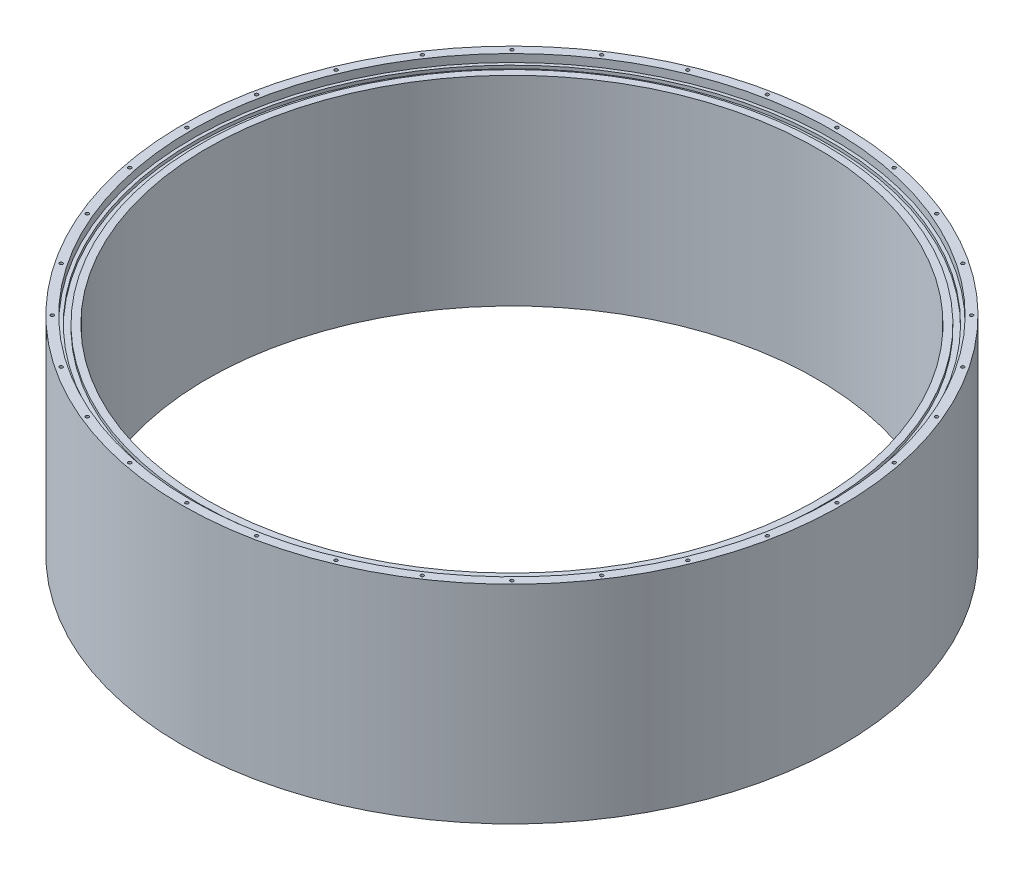
from build123d import *

# Parameters (mm, degrees)
SKETCH2_W         = 4.1656
SKETCH2_H         = 2.413
CIRPATTERN1_COUNT = 32


with BuildPart() as part:
    # Sketch1 → Revolve1 (revolve)
    with BuildSketch(Plane.XY, mode=Mode.PRIVATE) as revolve1_sk:
        Polygon((234.95, 74), (247, 74), (247, 80), (254, 80), (254, -80), (234.95, -80), align=None)
    revolve(revolve1_sk.sketch.rotate(Axis((0, 80, 0), (0, -1, 0)), 90), axis=Axis((0, 80, 0), (0, -1, 0)))

    # Sketch2 → Cut-Revolve1 (revolve, cut)
    with BuildSketch(Plane.XY, mode=Mode.PRIVATE) as cut_revolve1_sk:
        with Locations((242.4172, 72.7935)):
            Rectangle(SKETCH2_W, SKETCH2_H)
        with Locations((242.4172, -78.7935)):
            Rectangle(SKETCH2_W, SKETCH2_H)
    revolve(cut_revolve1_sk.sketch.rotate(Axis((0, 80, 0), (0, -1, 0)), 90), axis=Axis((0, 80, 0), (0, -1, 0)), mode=Mode.SUBTRACT)

    # Sketch4 → M3x0.5 Tapped Hole1 (revolve, cut)
    with BuildSketch(Plane(origin=(250.5, 80, 0), x_dir=(0, 0, 1), z_dir=(1, 0, 0))):
        Polygon((0, 0), (0, 10.251075774), (1.25, 9.5), (1.25, 0), align=None)
    m3x0_5_tapped_hole1 = revolve(axis=Axis((250.5, 86.35, 0), (0, -1, 0)), mode=Mode.SUBTRACT)

    # CirPattern1: M3x0.5 Tapped Hole1 ×32 about axis
    cirpattern1_axis = Axis((0, 0, 0), (0, 1, 0))
    for i in range(1, CIRPATTERN1_COUNT):
        add(m3x0_5_tapped_hole1.rotate(cirpattern1_axis, i * 360 / CIRPATTERN1_COUNT), mode=Mode.SUBTRACT)

    # Mirror1: M3x0.5 Tapped Hole1 across plane
    add(m3x0_5_tapped_hole1.mirror(Plane.ZX), mode=Mode.SUBTRACT)

    # Mirror1 copy 1 sketch → Mirror1 copy 1 (revolve, cut)
    with BuildSketch(Plane(origin=(245.686712741, -80, -48.870125665), x_dir=(0.19509032201612825, 0, 0.9807852804032304), z_dir=(0.9807852804032304, 0, -0.19509032201612825))):
        Polygon((0, 0), (0, -10.251075774), (1.25, -9.5), (1.25, 0), align=None)
    revolve(axis=Axis((245.686712741, -86.35, -48.870125665), (0, -1, 0)), mode=Mode.SUBTRACT)

    # Mirror1 copy 2 sketch → Mirror1 copy 2 (revolve, cut)
    with BuildSketch(Plane(origin=(231.431822894, -80, -95.862199807), x_dir=(0.3826834323650898, 0, 0.9238795325112867), z_dir=(0.9238795325112867, 0, -0.3826834323650898))):
        Polygon((0, 0), (0, -10.251075774), (1.25, -9.5), (1.25, 0), align=None)
    revolve(axis=Axis((231.431822894, -86.35, -95.862199807), (0, -1, 0)), mode=Mode.SUBTRACT)

    # Mirror1 copy 3 sketch → Mirror1 copy 3 (revolve, cut)
    with BuildSketch(Plane(origin=(208.283137882, -80, -139.170343371), x_dir=(0.5555702330196022, 0, 0.8314696123025452), z_dir=(0.8314696123025452, 0, -0.5555702330196022))):
        Polygon((0, 0), (0, -10.251075774), (1.25, -9.5), (1.25, 0), align=None)
    revolve(axis=Axis((208.283137882, -86.35, -139.170343371), (0, -1, 0)), mode=Mode.SUBTRACT)

    # Mirror1 copy 4 sketch → Mirror1 copy 4 (revolve, cut)
    with BuildSketch(Plane(origin=(177.130248687, -80, -177.130248687), x_dir=(0.7071067811865475, 0, 0.7071067811865476), z_dir=(0.7071067811865476, 0, -0.7071067811865475))):
        Polygon((0, 0), (0, -10.251075774), (1.25, -9.5), (1.25, 0), align=None)
    revolve(axis=Axis((177.130248687, -86.35, -177.130248687), (0, -1, 0)), mode=Mode.SUBTRACT)

    # Mirror1 copy 5 sketch → Mirror1 copy 5 (revolve, cut)
    with BuildSketch(Plane(origin=(139.170343371, -80, -208.283137882), x_dir=(0.8314696123025452, 0, 0.5555702330196023), z_dir=(0.5555702330196023, 0, -0.8314696123025452))):
        Polygon((0, 0), (0, -10.251075774), (1.25, -9.5), (1.25, 0), align=None)
    revolve(axis=Axis((139.170343371, -86.35, -208.283137882), (0, -1, 0)), mode=Mode.SUBTRACT)

    # Mirror1 copy 6 sketch → Mirror1 copy 6 (revolve, cut)
    with BuildSketch(Plane(origin=(95.862199807, -80, -231.431822894), x_dir=(0.9238795325112867, 0, 0.38268343236508984), z_dir=(0.38268343236508984, 0, -0.9238795325112867))):
        Polygon((0, 0), (0, -10.251075774), (1.25, -9.5), (1.25, 0), align=None)
    revolve(axis=Axis((95.862199807, -86.35, -231.431822894), (0, -1, 0)), mode=Mode.SUBTRACT)

    # Mirror1 copy 7 sketch → Mirror1 copy 7 (revolve, cut)
    with BuildSketch(Plane(origin=(48.870125665, -80, -245.686712741), x_dir=(0.9807852804032304, 0, 0.19509032201612833), z_dir=(0.19509032201612833, 0, -0.9807852804032304))):
        Polygon((0, 0), (0, -10.251075774), (1.25, -9.5), (1.25, 0), align=None)
    revolve(axis=Axis((48.870125665, -86.35, -245.686712741), (0, -1, 0)), mode=Mode.SUBTRACT)

    # Mirror1 copy 8 sketch → Mirror1 copy 8 (revolve, cut)
    with BuildSketch(Plane(origin=(0, -80, -250.5), x_dir=(1, 0, 0), z_dir=(0, 0, -1))):
        Polygon((0, 0), (0, -10.251075774), (1.25, -9.5), (1.25, 0), align=None)
    revolve(axis=Axis((0, -86.35, -250.5), (0, -1, 0)), mode=Mode.SUBTRACT)

    # Mirror1 copy 9 sketch → Mirror1 copy 9 (revolve, cut)
    with BuildSketch(Plane(origin=(-48.870125665, -80, -245.686712741), x_dir=(0.9807852804032304, 0, -0.1950903220161282), z_dir=(-0.1950903220161282, 0, -0.9807852804032304))):
        Polygon((0, 0), (0, -10.251075774), (1.25, -9.5), (1.25, 0), align=None)
    revolve(axis=Axis((-48.870125665, -86.35, -245.686712741), (0, -1, 0)), mode=Mode.SUBTRACT)

    # Mirror1 copy 10 sketch → Mirror1 copy 10 (revolve, cut)
    with BuildSketch(Plane(origin=(-95.862199807, -80, -231.431822894), x_dir=(0.9238795325112867, 0, -0.3826834323650897), z_dir=(-0.3826834323650897, 0, -0.9238795325112867))):
        Polygon((0, 0), (0, -10.251075774), (1.25, -9.5), (1.25, 0), align=None)
    revolve(axis=Axis((-95.862199807, -86.35, -231.431822894), (0, -1, 0)), mode=Mode.SUBTRACT)

    # Mirror1 copy 11 sketch → Mirror1 copy 11 (revolve, cut)
    with BuildSketch(Plane(origin=(-139.170343371, -80, -208.283137882), x_dir=(0.8314696123025451, 0, -0.5555702330196023), z_dir=(-0.5555702330196023, 0, -0.8314696123025451))):
        Polygon((0, 0), (0, -10.251075774), (1.25, -9.5), (1.25, 0), align=None)
    revolve(axis=Axis((-139.170343371, -86.35, -208.283137882), (0, -1, 0)), mode=Mode.SUBTRACT)

    # Mirror1 copy 12 sketch → Mirror1 copy 12 (revolve, cut)
    with BuildSketch(Plane(origin=(-177.130248687, -80, -177.130248687), x_dir=(0.7071067811865476, 0, -0.7071067811865475), z_dir=(-0.7071067811865475, 0, -0.7071067811865476))):
        Polygon((0, 0), (0, -10.251075774), (1.25, -9.5), (1.25, 0), align=None)
    revolve(axis=Axis((-177.130248687, -86.35, -177.130248687), (0, -1, 0)), mode=Mode.SUBTRACT)

    # Mirror1 copy 13 sketch → Mirror1 copy 13 (revolve, cut)
    with BuildSketch(Plane(origin=(-208.283137882, -80, -139.170343371), x_dir=(0.5555702330196022, 0, -0.8314696123025453), z_dir=(-0.8314696123025453, 0, -0.5555702330196022))):
        Polygon((0, 0), (0, -10.251075774), (1.25, -9.5), (1.25, 0), align=None)
    revolve(axis=Axis((-208.283137882, -86.35, -139.170343371), (0, -1, 0)), mode=Mode.SUBTRACT)

    # Mirror1 copy 14 sketch → Mirror1 copy 14 (revolve, cut)
    with BuildSketch(Plane(origin=(-231.431822894, -80, -95.862199807), x_dir=(0.3826834323650899, 0, -0.9238795325112867), z_dir=(-0.9238795325112867, 0, -0.3826834323650899))):
        Polygon((0, 0), (0, -10.251075774), (1.25, -9.5), (1.25, 0), align=None)
    revolve(axis=Axis((-231.431822894, -86.35, -95.862199807), (0, -1, 0)), mode=Mode.SUBTRACT)

    # Mirror1 copy 15 sketch → Mirror1 copy 15 (revolve, cut)
    with BuildSketch(Plane(origin=(-245.686712741, -80, -48.870125665), x_dir=(0.19509032201612816, 0, -0.9807852804032304), z_dir=(-0.9807852804032304, 0, -0.19509032201612816))):
        Polygon((0, 0), (0, -10.251075774), (1.25, -9.5), (1.25, 0), align=None)
    revolve(axis=Axis((-245.686712741, -86.35, -48.870125665), (0, -1, 0)), mode=Mode.SUBTRACT)

    # Mirror1 copy 16 sketch → Mirror1 copy 16 (revolve, cut)
    with BuildSketch(Plane(origin=(-250.5, -80, 0), x_dir=(0, 0, -1), z_dir=(-1, 0, 0))):
        Polygon((0, 0), (0, -10.251075774), (1.25, -9.5), (1.25, 0), align=None)
    revolve(axis=Axis((-250.5, -86.35, 0), (0, -1, 0)), mode=Mode.SUBTRACT)

    # Mirror1 copy 17 sketch → Mirror1 copy 17 (revolve, cut)
    with BuildSketch(Plane(origin=(-245.686712741, -80, 48.870125665), x_dir=(-0.19509032201612836, 0, -0.9807852804032304), z_dir=(-0.9807852804032304, 0, 0.19509032201612836))):
        Polygon((0, 0), (0, -10.251075774), (1.25, -9.5), (1.25, 0), align=None)
    revolve(axis=Axis((-245.686712741, -86.35, 48.870125665), (0, -1, 0)), mode=Mode.SUBTRACT)

    # Mirror1 copy 18 sketch → Mirror1 copy 18 (revolve, cut)
    with BuildSketch(Plane(origin=(-231.431822894, -80, 95.862199807), x_dir=(-0.38268343236508967, 0, -0.9238795325112868), z_dir=(-0.9238795325112868, 0, 0.38268343236508967))):
        Polygon((0, 0), (0, -10.251075774), (1.25, -9.5), (1.25, 0), align=None)
    revolve(axis=Axis((-231.431822894, -86.35, 95.862199807), (0, -1, 0)), mode=Mode.SUBTRACT)

    # Mirror1 copy 19 sketch → Mirror1 copy 19 (revolve, cut)
    with BuildSketch(Plane(origin=(-208.283137882, -80, 139.170343371), x_dir=(-0.5555702330196023, 0, -0.8314696123025452), z_dir=(-0.8314696123025452, 0, 0.5555702330196023))):
        Polygon((0, 0), (0, -10.251075774), (1.25, -9.5), (1.25, 0), align=None)
    revolve(axis=Axis((-208.283137882, -86.35, 139.170343371), (0, -1, 0)), mode=Mode.SUBTRACT)

    # Mirror1 copy 20 sketch → Mirror1 copy 20 (revolve, cut)
    with BuildSketch(Plane(origin=(-177.130248687, -80, 177.130248687), x_dir=(-0.7071067811865475, 0, -0.7071067811865477), z_dir=(-0.7071067811865477, 0, 0.7071067811865475))):
        Polygon((0, 0), (0, -10.251075774), (1.25, -9.5), (1.25, 0), align=None)
    revolve(axis=Axis((-177.130248687, -86.35, 177.130248687), (0, -1, 0)), mode=Mode.SUBTRACT)

    # Mirror1 copy 21 sketch → Mirror1 copy 21 (revolve, cut)
    with BuildSketch(Plane(origin=(-139.170343371, -80, 208.283137882), x_dir=(-0.8314696123025452, 0, -0.5555702330196022), z_dir=(-0.5555702330196022, 0, 0.8314696123025452))):
        Polygon((0, 0), (0, -10.251075774), (1.25, -9.5), (1.25, 0), align=None)
    revolve(axis=Axis((-139.170343371, -86.35, 208.283137882), (0, -1, 0)), mode=Mode.SUBTRACT)

    # Mirror1 copy 22 sketch → Mirror1 copy 22 (revolve, cut)
    with BuildSketch(Plane(origin=(-95.862199807, -80, 231.431822894), x_dir=(-0.9238795325112868, 0, -0.3826834323650895), z_dir=(-0.3826834323650895, 0, 0.9238795325112868))):
        Polygon((0, 0), (0, -10.251075774), (1.25, -9.5), (1.25, 0), align=None)
    revolve(axis=Axis((-95.862199807, -86.35, 231.431822894), (0, -1, 0)), mode=Mode.SUBTRACT)

    # Mirror1 copy 23 sketch → Mirror1 copy 23 (revolve, cut)
    with BuildSketch(Plane(origin=(-48.870125665, -80, 245.686712741), x_dir=(-0.9807852804032303, 0, -0.19509032201612866), z_dir=(-0.19509032201612866, 0, 0.9807852804032303))):
        Polygon((0, 0), (0, -10.251075774), (1.25, -9.5), (1.25, 0), align=None)
    revolve(axis=Axis((-48.870125665, -86.35, 245.686712741), (0, -1, 0)), mode=Mode.SUBTRACT)

    # Mirror1 copy 24 sketch → Mirror1 copy 24 (revolve, cut)
    with BuildSketch(Plane(origin=(0, -80, 250.5), x_dir=(-1, 0, 0), z_dir=(0, 0, 1))):
        Polygon((0, 0), (0, -10.251075774), (1.25, -9.5), (1.25, 0), align=None)
    revolve(axis=Axis((0, -86.35, 250.5), (0, -1, 0)), mode=Mode.SUBTRACT)

    # Mirror1 copy 25 sketch → Mirror1 copy 25 (revolve, cut)
    with BuildSketch(Plane(origin=(48.870125665, -80, 245.686712741), x_dir=(-0.9807852804032304, 0, 0.1950903220161283), z_dir=(0.1950903220161283, 0, 0.9807852804032304))):
        Polygon((0, 0), (0, -10.251075774), (1.25, -9.5), (1.25, 0), align=None)
    revolve(axis=Axis((48.870125665, -86.35, 245.686712741), (0, -1, 0)), mode=Mode.SUBTRACT)

    # Mirror1 copy 26 sketch → Mirror1 copy 26 (revolve, cut)
    with BuildSketch(Plane(origin=(95.862199807, -80, 231.431822894), x_dir=(-0.9238795325112866, 0, 0.38268343236509), z_dir=(0.38268343236509, 0, 0.9238795325112866))):
        Polygon((0, 0), (0, -10.251075774), (1.25, -9.5), (1.25, 0), align=None)
    revolve(axis=Axis((95.862199807, -86.35, 231.431822894), (0, -1, 0)), mode=Mode.SUBTRACT)

    # Mirror1 copy 27 sketch → Mirror1 copy 27 (revolve, cut)
    with BuildSketch(Plane(origin=(139.170343371, -80, 208.283137882), x_dir=(-0.8314696123025455, 0, 0.5555702330196018), z_dir=(0.5555702330196018, 0, 0.8314696123025455))):
        Polygon((0, 0), (0, -10.251075774), (1.25, -9.5), (1.25, 0), align=None)
    revolve(axis=Axis((139.170343371, -86.35, 208.283137882), (0, -1, 0)), mode=Mode.SUBTRACT)

    # Mirror1 copy 28 sketch → Mirror1 copy 28 (revolve, cut)
    with BuildSketch(Plane(origin=(177.130248687, -80, 177.130248687), x_dir=(-0.7071067811865477, 0, 0.7071067811865474), z_dir=(0.7071067811865474, 0, 0.7071067811865477))):
        Polygon((0, 0), (0, -10.251075774), (1.25, -9.5), (1.25, 0), align=None)
    revolve(axis=Axis((177.130248687, -86.35, 177.130248687), (0, -1, 0)), mode=Mode.SUBTRACT)

    # Mirror1 copy 29 sketch → Mirror1 copy 29 (revolve, cut)
    with BuildSketch(Plane(origin=(208.283137882, -80, 139.170343371), x_dir=(-0.5555702330196022, 0, 0.8314696123025452), z_dir=(0.8314696123025452, 0, 0.5555702330196022))):
        Polygon((0, 0), (0, -10.251075774), (1.25, -9.5), (1.25, 0), align=None)
    revolve(axis=Axis((208.283137882, -86.35, 139.170343371), (0, -1, 0)), mode=Mode.SUBTRACT)

    # Mirror1 copy 30 sketch → Mirror1 copy 30 (revolve, cut)
    with BuildSketch(Plane(origin=(231.431822894, -80, 95.862199807), x_dir=(-0.38268343236508956, 0, 0.9238795325112868), z_dir=(0.9238795325112868, 0, 0.38268343236508956))):
        Polygon((0, 0), (0, -10.251075774), (1.25, -9.5), (1.25, 0), align=None)
    revolve(axis=Axis((231.431822894, -86.35, 95.862199807), (0, -1, 0)), mode=Mode.SUBTRACT)

    # Mirror1 copy 31 sketch → Mirror1 copy 31 (revolve, cut)
    with BuildSketch(Plane(origin=(245.686712741, -80, 48.870125665), x_dir=(-0.19509032201612872, 0, 0.9807852804032303), z_dir=(0.9807852804032303, 0, 0.19509032201612872))):
        Polygon((0, 0), (0, -10.251075774), (1.25, -9.5), (1.25, 0), align=None)
    revolve(axis=Axis((245.686712741, -86.35, 48.870125665), (0, -1, 0)), mode=Mode.SUBTRACT)


solid = part.part
